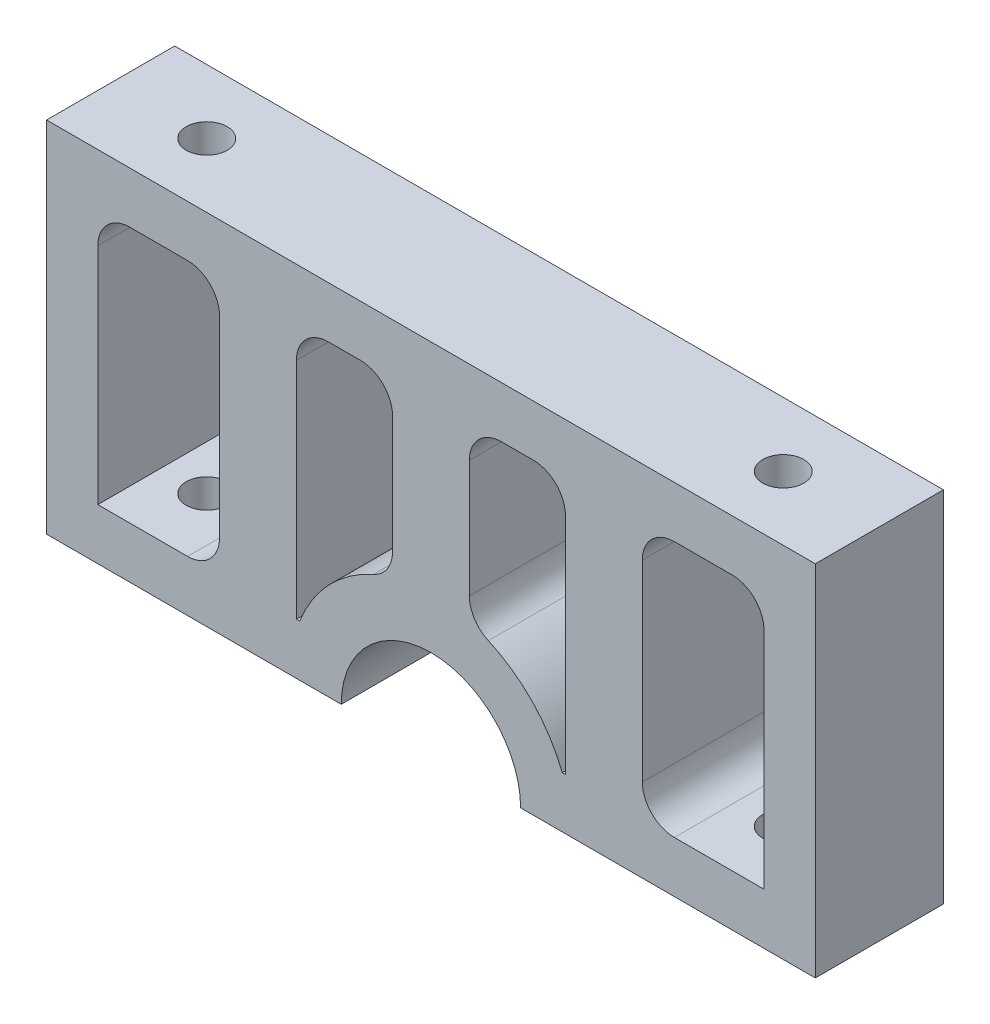
from build123d import *

# Parameters (mm, degrees)
EXTRUDE_1_DEPTH     = 10
SKETCH_2_W          = 9.5
SKETCH_2_H          = 20
CUT_EXTRUDE_2_DEPTH = 15
FILLET_1_R          = 2.5
SKETCH_3_R          = 1.6
CUT_EXTRUDE_1_DEPTH = 43.237424164


with BuildPart() as part:
    # ｽｹｯﾁ1 → ﾎﾞｽ - 押し出し1 (new body)
    with BuildSketch(Plane.XY):
        with BuildLine():
            Line((-30, 28), (-30, 0))
            Line((-30, 0), (-7, 0))
            ThreePointArc((-7, 0), (-4.949747468, 4.949747468), (0, 7))
            Line((0, 7), (0, 28))
            Line((0, 28), (-30, 28))
        make_face()
        with BuildLine():
            Line((7, 0), (30, 0))
            Line((30, 0), (30, 28))
            Line((30, 28), (0, 28))
            Line((0, 28), (0, 7))
            ThreePointArc((0, 7), (4.949747468, 4.949747468), (7, 0))
        make_face()
    extrude(amount=EXTRUDE_1_DEPTH)

    # ｽｹｯﾁ2 → ｶｯﾄ - 押し出し2 (cut)
    with BuildSketch(Plane.XY.offset(10)):
        with BuildLine():
            Line((10.5, 24), (3, 24))
            Line((3, 24), (3, 10.583005244))
            ThreePointArc((3, 10.583005244), (7.396243348, 8.14221004), (10.246950766, 4))
            Line((10.246950766, 4), (10.5, 4))
            Line((10.5, 4), (10.5, 24))
        make_face()
        with BuildLine():
            Line((-3, 10.583005244), (-3, 24))
            Line((-3, 24), (-10.5, 24))
            Line((-10.5, 24), (-10.5, 4))
            Line((-10.5, 4), (-10.246950766, 4))
            ThreePointArc((-10.246950766, 4), (-7.396243348, 8.14221004), (-3, 10.583005244))
        make_face()
        with Locations((21.25, 14)):
            Rectangle(SKETCH_2_W, SKETCH_2_H)
        with Locations((-21.25, 14)):
            Rectangle(SKETCH_2_W, SKETCH_2_H)
    extrude(amount=-CUT_EXTRUDE_2_DEPTH, mode=Mode.SUBTRACT)

    # ﾌｨﾚｯﾄ1
    fillet_1_edges = [part.edges().sort_by_distance(p)[0] for p in [
        (16.5, 4, 5),
        (16.5, 24, 5),
        (26, 24, 5),
        (3, 10.583005244, 5),
        (3, 24, 5),
        (10.5, 24, 5),
        (-3, 10.583005244, 5),
        (-10.5, 24, 5),
        (-3, 24, 5),
        (-16.5, 4, 5),
        (-26, 24, 5),
        (-16.5, 24, 5),
    ]]
    fillet(fillet_1_edges, radius=FILLET_1_R)

    # ｽｹｯﾁ3 → ｶｯﾄ - 押し出し1 (cut, through all)
    with BuildSketch(Plane(origin=(0, 28, 0), x_dir=(1, 0, 0), z_dir=(0, 1, 0))):
        with Locations(Location((-22.5, -5, 0), (0, 0, 270))):
            Circle(SKETCH_3_R)
        with Locations(Location((22.5, -5, 0), (0, 0, 270))):
            Circle(SKETCH_3_R)
    extrude(amount=-CUT_EXTRUDE_1_DEPTH, mode=Mode.SUBTRACT)


solid = part.part
